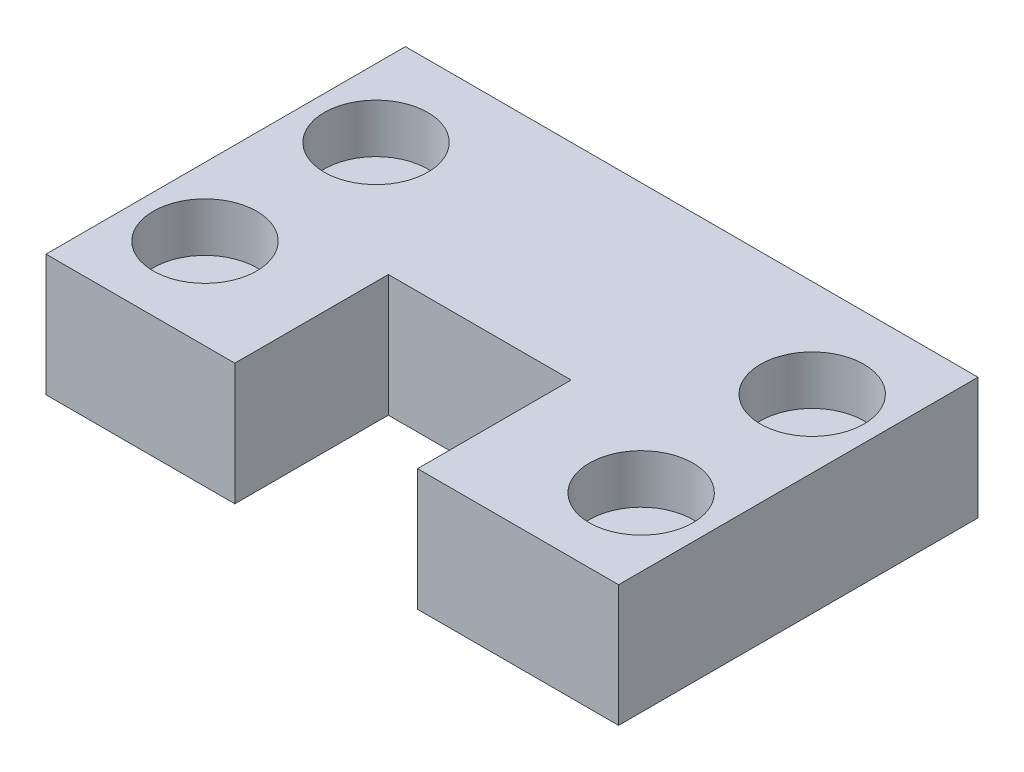
from build123d import *

# Parameters (mm, degrees)
BOSS_EXTRUDE2_DEPTH = 10
SKETCH2_R           = 4.25
CUT_EXTRUDE1_DEPTH  = 4.02
SKETCH3_R           = 1.3
CUT_EXTRUDE2_DEPTH  = 56.812278219


with BuildPart() as part:
    # Sketch1 → Boss-Extrude2 (new body)
    with BuildSketch(Plane(origin=(0, 0, 0), x_dir=(1, 0, 0), z_dir=(0, 1, 0))):
        Polygon((0, 0), (0, 29.5), (47, 29.5), (47, 0), (30.5, 0), (30.5, 12.6), (15.5, 12.6), (15.5, 0), align=None)
    extrude(amount=BOSS_EXTRUDE2_DEPTH)

    # Sketch2 → Cut-Extrude1 (cut)
    with BuildSketch(Plane(origin=(0, 10, 0), x_dir=(1, 0, 0), z_dir=(0, 1, 0))):
        with Locations(Location((41.4, 7.45, 0), (0, 0, 270))):
            Circle(SKETCH2_R)
        with Locations(Location((5.6, 7.45, 0), (0, 0, 90))):
            Circle(SKETCH2_R)
        with Locations(Location((5.6, 21.49, 0), (0, 0, 270))):
            Circle(SKETCH2_R)
        with Locations(Location((41.4, 21.49, 0), (0, 0, 90))):
            Circle(SKETCH2_R)
    extrude(amount=-CUT_EXTRUDE1_DEPTH, mode=Mode.SUBTRACT)

    # Sketch3 → Cut-Extrude2 (cut, through all)
    with BuildSketch(Plane(origin=(0, 5.98, 0), x_dir=(1, 0, 0), z_dir=(0, 1, 0))):
        with Locations(Location((5.6, 7.45, 0), (0, 0, 270))):
            Circle(SKETCH3_R)
        with Locations(Location((41.4, 7.45, 0), (0, 0, 270))):
            Circle(SKETCH3_R)
        with Locations(Location((5.6, 21.49, 0), (0, 0, 270))):
            Circle(SKETCH3_R)
        with Locations(Location((41.4, 21.49, 0), (0, 0, 270))):
            Circle(SKETCH3_R)
    extrude(amount=-CUT_EXTRUDE2_DEPTH, mode=Mode.SUBTRACT)


solid = part.part
